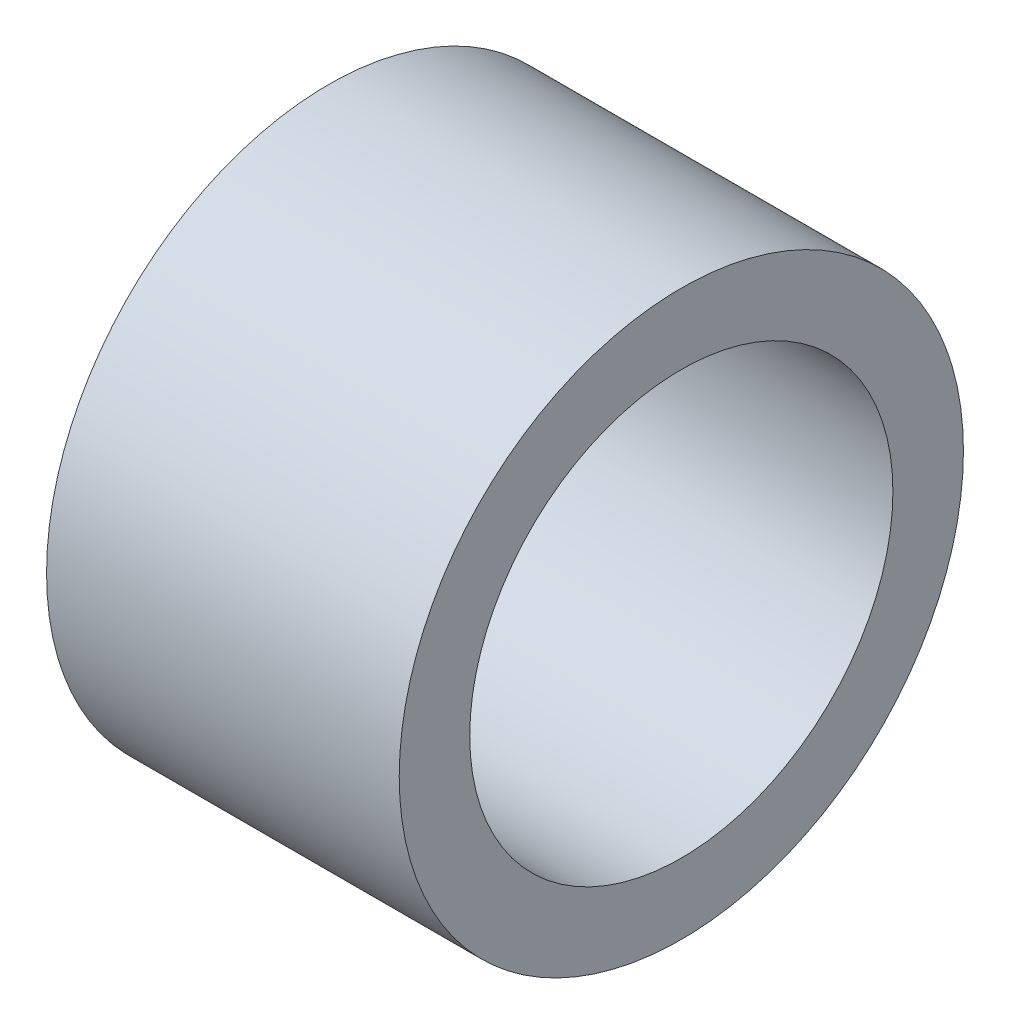
from build123d import *
from build123d.topology import SkipClean

# Parameters (mm, degrees)
CAGSPISKE_W         = 16
CAGSPISKE_H         = 0.7
SKETCH1_R           = 16
SKETCH1_R_2         = 12
BOSS_EXTRUDE1_DEPTH = 10


with BuildPart() as part:
    # CagSpiSke → CageSpine (revolve)
    with BuildSketch(Plane.XY):
        with Locations((0, 14.25)):
            Rectangle(CAGSPISKE_W, CAGSPISKE_H)
    revolve(axis=Axis((-12.7, 0, 0), (1, 0, 0)))

    # RolSimSke → RollersSimplified (revolve)
    with BuildSketch(Plane.XY):
        with BuildLine():
            Line((-7.13, 16), (7.13, 16))
            ThreePointArc((7.13, 16), (7.179497475, 15.979497475), (7.2, 15.93))
            Line((7.2, 15.93), (7.2, 12.57))
            ThreePointArc((7.2, 12.57), (7.179497475, 12.520502525), (7.13, 12.5))
            Line((7.13, 12.5), (-7.13, 12.5))
            ThreePointArc((-7.13, 12.5), (-7.179497475, 12.520502525), (-7.2, 12.57))
            Line((-7.2, 12.57), (-7.2, 15.93))
            ThreePointArc((-7.2, 15.93), (-7.179497475, 15.979497475), (-7.13, 16))
        make_face()
    revolve(axis=Axis((-17.78, 0, 0), (1, 0, 0)))

    # Sketch1 → Boss-Extrude1 (add, symmetric)
    with SkipClean():  # the faces are left unmerged after this step: merging them gives an invalid solid
        with BuildSketch(Plane(origin=(0, 0, 0), x_dir=(0, 0, -1), z_dir=(1, 0, 0))):
            Circle(SKETCH1_R)
            Circle(SKETCH1_R_2, mode=Mode.SUBTRACT)
        extrude(amount=BOSS_EXTRUDE1_DEPTH, both=True)
    add(part.part.scale(1), mode=Mode.REPLACE)  # the faces are merged on a copy


solid = part.part
